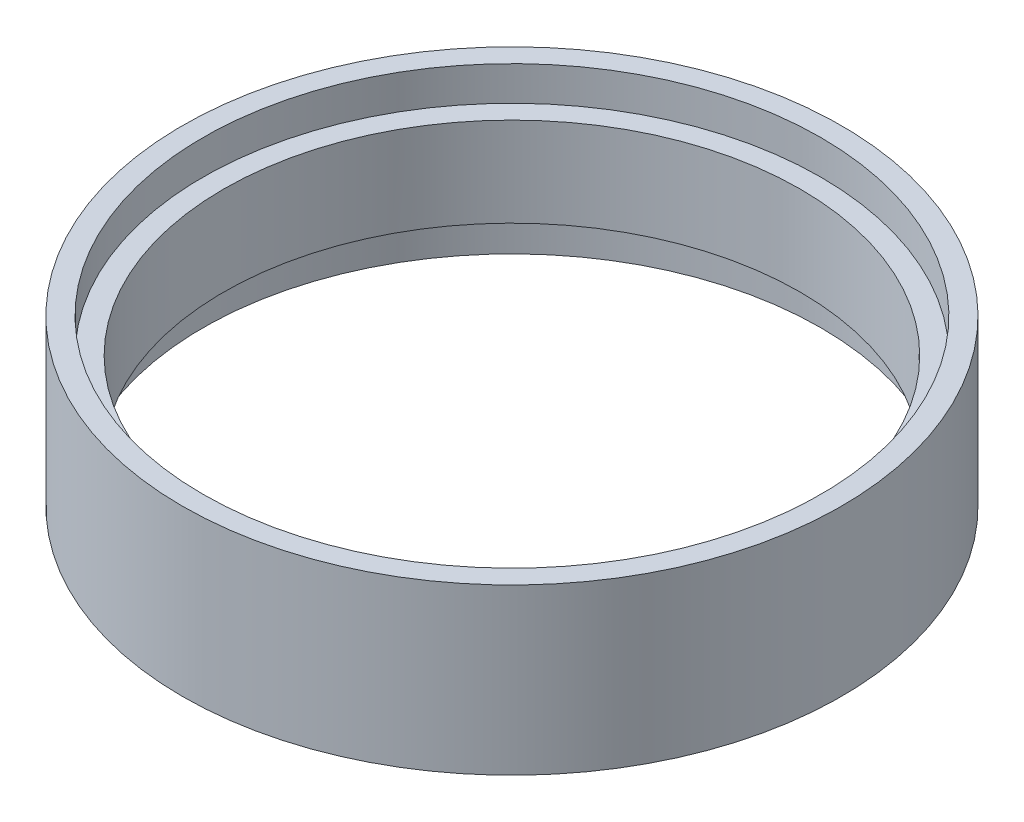
from build123d import *

# Parameters (mm, degrees)
SKIZZE1_R                       = 48
SKIZZE1_R_2                     = 42
AUFSATZ_LINEAR_AUSTRAGEN2_DEPTH = 24
SKIZZE2_R                       = 45
SCHNITT_LINEAR_AUSTRAGEN1_DEPTH = 5
SCHNITT_LINEAR_START            = -6
SKIZZE4_R                       = 45
SCHNITT_LINEAR_AUSTRAGEN2_DEPTH = 6


with BuildPart() as part:
    # Skizze1 → Aufsatz-Linear austragen2 (new body)
    with BuildSketch(Plane(origin=(0, 0, 0), x_dir=(1, 0, 0), z_dir=(0, 1, 0))):
        with Locations(Location((0, 0, 0), (0, 0, 270))):
            Circle(SKIZZE1_R)
        with Locations(Location((0, 0, 0), (0, 0, 270))):
            Circle(SKIZZE1_R_2, mode=Mode.SUBTRACT)
    extrude(amount=AUFSATZ_LINEAR_AUSTRAGEN2_DEPTH)

    # Skizze2 → Schnitt-Linear austragen1 (cut)
    with BuildSketch(Plane(origin=(0, 24, 0), x_dir=(1, 0, 0), z_dir=(0, 1, 0))):
        with Locations(Location((0, 0, 0), (0, 0, 270))):
            Circle(SKIZZE2_R)
    extrude(amount=-SCHNITT_LINEAR_AUSTRAGEN1_DEPTH, mode=Mode.SUBTRACT)

    # Skizze4 → Schnitt-Linear austragen2 (cut)
    with BuildSketch(Plane.XZ.offset(SCHNITT_LINEAR_START)):
        with Locations(Location((0, 0, 0), (0, 0, 90))):
            Circle(SKIZZE4_R)
    extrude(amount=SCHNITT_LINEAR_AUSTRAGEN2_DEPTH, mode=Mode.SUBTRACT)


solid = part.part
